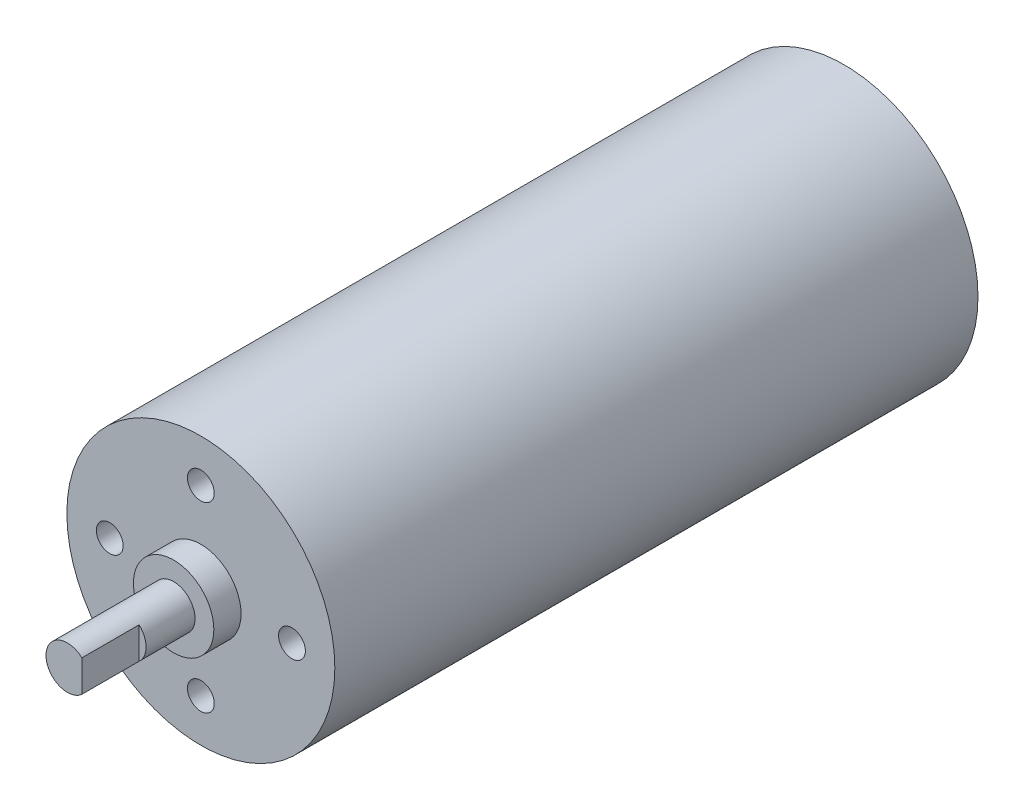
from build123d import *

# Parameters (mm, degrees)
SKETCH1_R                       = 12.5
BOSS_EXTRUDE1_DEPTH             = 60
SKETCH4_R                       = 2
BOSS_EXTRUDE3_DEPTH             = 12.446
SKETCH5_R                       = 3.75
BOSS_EXTRUDE4_DEPTH             = 2.54
CUT_EXTRUDE2_START              = -5.334
CUT_EXTRUDE2_DEPTH              = 5.334
TAP_DRILL_FOR_M3X0_5_TAP1_D     = 2.5
TAP_DRILL_FOR_M3X0_5_TAP1_DEPTH = 10.0000054
TAP_DRILL_FOR_M3X0_5_TAP1_TIP   = 0.751075774


with BuildPart() as part:
    # Sketch1 → Boss-Extrude1 (new body)
    with BuildSketch(Plane.XY):
        Circle(SKETCH1_R)
    extrude(amount=-BOSS_EXTRUDE1_DEPTH)

    # Sketch4 → Boss-Extrude3 (add)
    with BuildSketch(Plane.XY):
        Circle(SKETCH4_R)
    extrude(amount=BOSS_EXTRUDE3_DEPTH)

    # Sketch5 → Boss-Extrude4 (add)
    with BuildSketch(Plane.XY):
        Circle(SKETCH5_R)
    extrude(amount=BOSS_EXTRUDE4_DEPTH)

    # Sketch6 → Cut-Extrude2 (cut)
    with BuildSketch(Plane.XY.offset(12.446).offset(CUT_EXTRUDE2_START)):
        with BuildLine():
            Line((1.35278764, 1.473080311), (1.35278764, -1.473080311))
            ThreePointArc((1.35278764, -1.473080311), (2, 0), (1.35278764, 1.473080311))
        make_face()
    extrude(amount=CUT_EXTRUDE2_DEPTH, mode=Mode.SUBTRACT)

    # Tap Drill for M3x0.5 Tap1
    with Locations(Plane.XY):
        with Locations((0, 8.5), (8.5, 0), (0, -8.5), (-8.5, 0)):
            Hole(TAP_DRILL_FOR_M3X0_5_TAP1_D / 2, depth=TAP_DRILL_FOR_M3X0_5_TAP1_DEPTH)
            with Locations((0, 0, -(TAP_DRILL_FOR_M3X0_5_TAP1_DEPTH + TAP_DRILL_FOR_M3X0_5_TAP1_TIP / 2))):  # 118° drill point
                Cone(0, TAP_DRILL_FOR_M3X0_5_TAP1_D / 2, TAP_DRILL_FOR_M3X0_5_TAP1_TIP, mode=Mode.SUBTRACT)


solid = part.part
